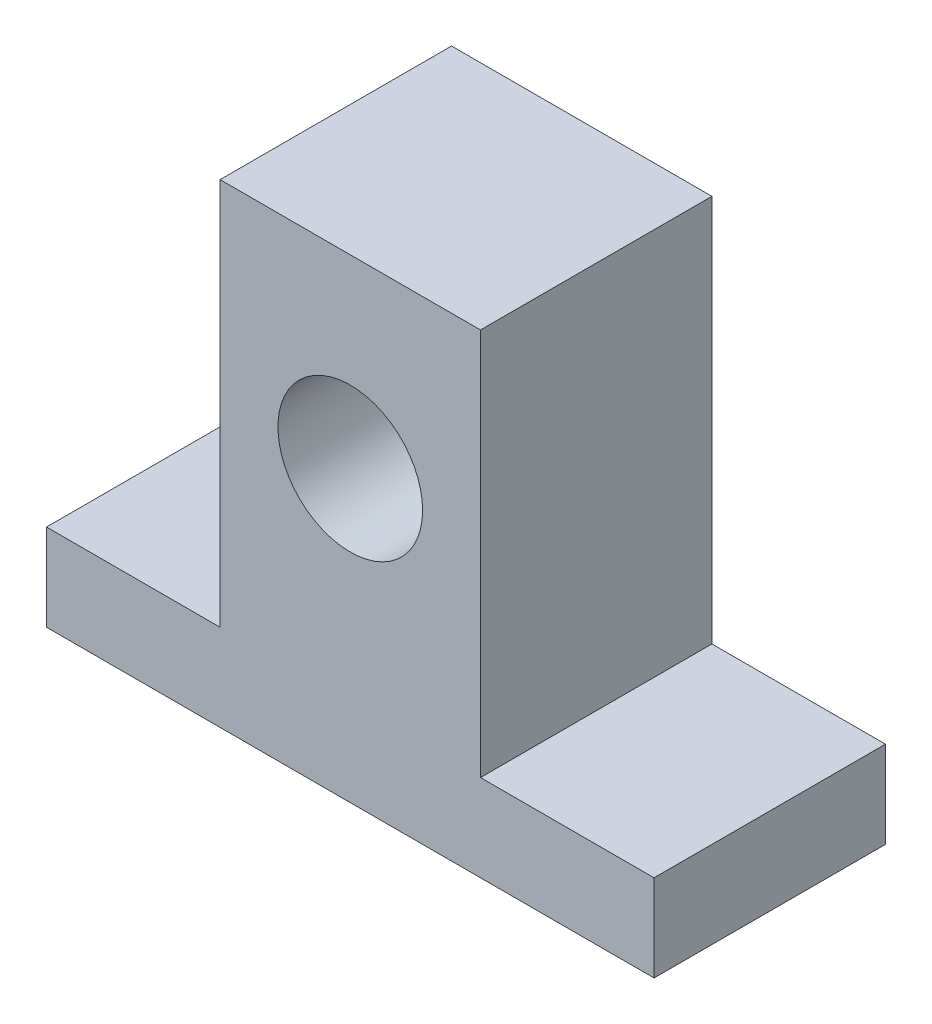
from build123d import *

# Parameters (mm, degrees)
SKETCH_1_R      = 5
EXTRUDE_1_DEPTH = 16


with BuildPart() as part:
    # 草圖1 → 填料-伸長1 (new body)
    with BuildSketch(Plane.XY):
        Polygon((9, 32.8), (-9, 32.8), (-9, 6), (-21, 6), (-21, 0), (21, 0), (21, 6), (9, 6), align=None)
        with Locations((0, 20)):
            Circle(SKETCH_1_R, mode=Mode.SUBTRACT)
    extrude(amount=EXTRUDE_1_DEPTH)


solid = part.part
